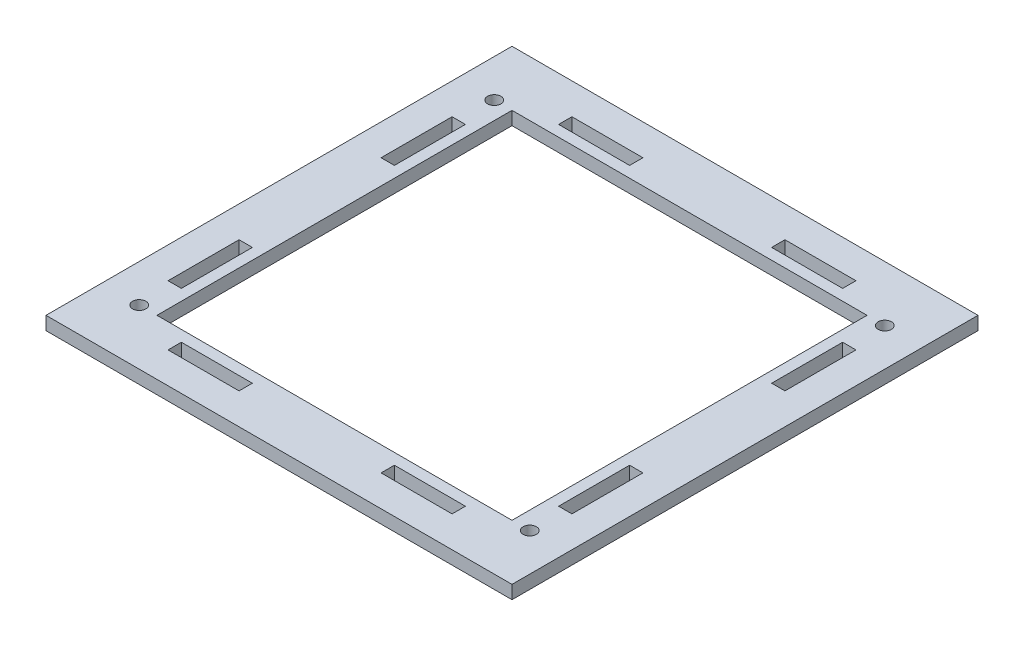
from build123d import *

# Parameters (mm, degrees)
CROQUIS1_W              = 105
CROQUIS1_H              = 105
CROQUIS1_R              = 1.5
CROQUIS1_W_2            = 80
CROQUIS1_H_2            = 80
CROQUIS1_W_3            = 16
CROQUIS1_H_3            = 3
CROQUIS1_W_4            = 3
CROQUIS1_H_4            = 16
SALIENTE_EXTRUIR1_DEPTH = 3


with BuildPart() as part:
    # Croquis1 → Saliente-Extruir1 (new body)
    with BuildSketch(Plane(origin=(0, 0, 0), x_dir=(1, 0, 0), z_dir=(0, 1, 0))):
        with Locations((40, 40)):
            Rectangle(CROQUIS1_W, CROQUIS1_H)
        with Locations(Location((84, 0, 0), (0, 0, 270))):
            Circle(CROQUIS1_R, mode=Mode.SUBTRACT)
        with Locations(Location((84, 80, 0), (0, 0, 90))):
            Circle(CROQUIS1_R, mode=Mode.SUBTRACT)
        with Locations(Location((-4, 80, 0), (0, 0, 270))):
            Circle(CROQUIS1_R, mode=Mode.SUBTRACT)
        with Locations(Location((-4, 0, 0), (0, 0, 90))):
            Circle(CROQUIS1_R, mode=Mode.SUBTRACT)
        with Locations((40, 40)):
            Rectangle(CROQUIS1_W_2, CROQUIS1_H_2, mode=Mode.SUBTRACT)
        with Locations((16, -4)):
            Rectangle(CROQUIS1_W_3, CROQUIS1_H_3, mode=Mode.SUBTRACT)
        with Locations((84, 64)):
            Rectangle(CROQUIS1_W_4, CROQUIS1_H_4, mode=Mode.SUBTRACT)
        with Locations((84, 16)):
            Rectangle(CROQUIS1_W_4, CROQUIS1_H_4, mode=Mode.SUBTRACT)
        with Locations((-4, 16)):
            Rectangle(CROQUIS1_W_4, CROQUIS1_H_4, mode=Mode.SUBTRACT)
        with Locations((-4, 64)):
            Rectangle(CROQUIS1_W_4, CROQUIS1_H_4, mode=Mode.SUBTRACT)
        with Locations((64, -4)):
            Rectangle(CROQUIS1_W_3, CROQUIS1_H_3, mode=Mode.SUBTRACT)
        with Locations((64, 84)):
            Rectangle(CROQUIS1_W_3, CROQUIS1_H_3, mode=Mode.SUBTRACT)
        with Locations((16, 84)):
            Rectangle(CROQUIS1_W_3, CROQUIS1_H_3, mode=Mode.SUBTRACT)
    extrude(amount=SALIENTE_EXTRUIR1_DEPTH)


solid = part.part
